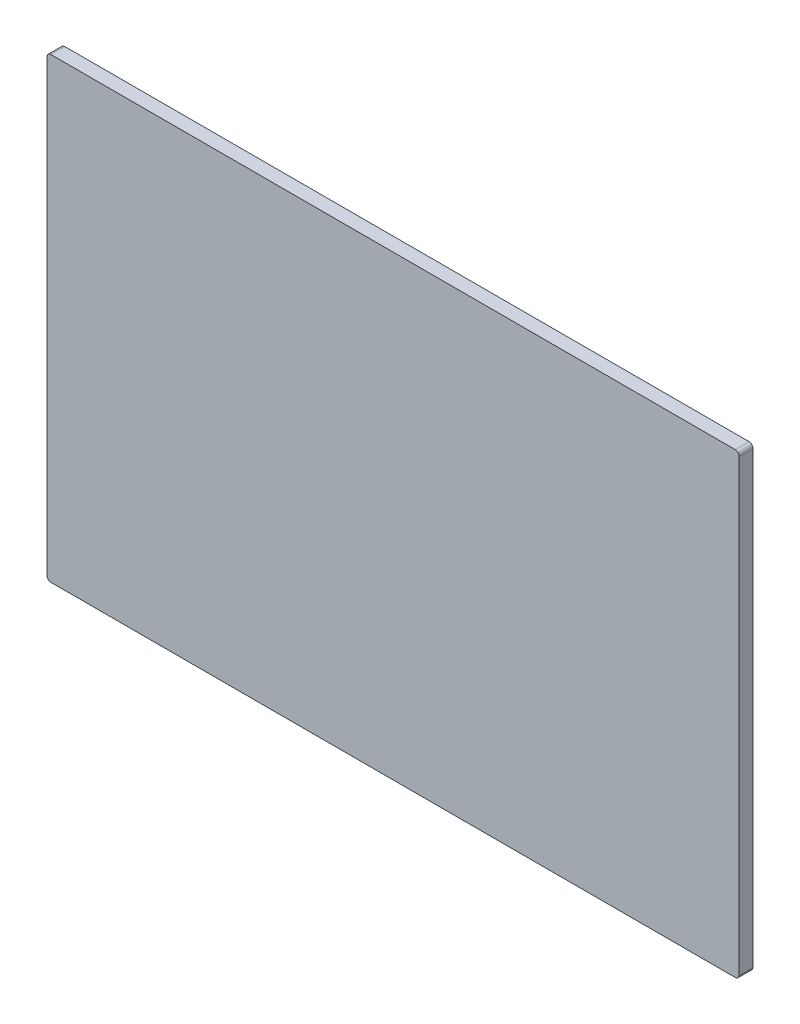
from build123d import *

# Parameters (mm, degrees)
SKETCH1_W           = 870
SKETCH1_H           = 574.487
BOSS_EXTRUDE1_DEPTH = 17.4
FILLET1_R           = 5
FILLET2_R           = 5
FILLET3_R           = 5
FILLET4_R           = 5


with BuildPart() as part:
    # Sketch1 → Boss-Extrude1 (new body)
    with BuildSketch(Plane.XY):
        with Locations((530, 312.7765)):
            Rectangle(SKETCH1_W, SKETCH1_H)
    extrude(amount=BOSS_EXTRUDE1_DEPTH)

    # Fillet1
    fillet1_edges = [part.edges().sort_by_distance(p)[0] for p in [
        (965, 600.02, 8.7),
    ]]
    fillet(fillet1_edges, radius=FILLET1_R)

    # Fillet2
    fillet2_edges = [part.edges().sort_by_distance(p)[0] for p in [
        (95, 600.02, 8.7),
    ]]
    fillet(fillet2_edges, radius=FILLET2_R)

    # Fillet3
    fillet3_edges = [part.edges().sort_by_distance(p)[0] for p in [
        (95, 25.533, 8.7),
    ]]
    fillet(fillet3_edges, radius=FILLET3_R)

    # Fillet4
    fillet4_edges = [part.edges().sort_by_distance(p)[0] for p in [
        (965, 25.533, 8.7),
    ]]
    fillet(fillet4_edges, radius=FILLET4_R)


solid = part.part
